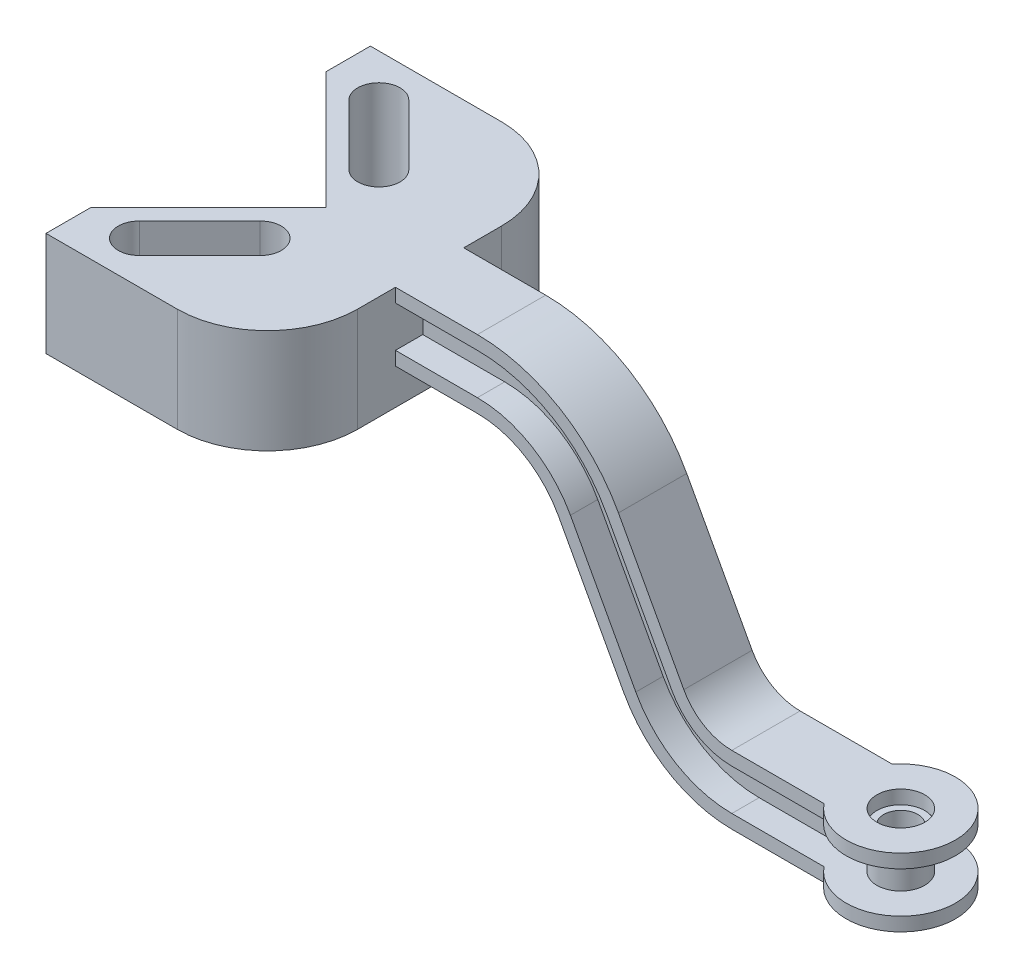
from build123d import *

# Parameters (mm, degrees)
BOSS_EXTRUDE1_DEPTH = 10
BOSS_EXTRUDE2_DEPTH = 50
BOSS_EXTRUDE5_START = 20
BOSS_EXTRUDE5_DEPTH = 152.5
BOSS_EXTRUDE6_START = -421.013827
SKETCH5_3_R         = 80
SKETCH5_3_R_2       = 35
BOSS_EXTRUDE6_DEPTH = 20
BOSS_EXTRUDE7_START = -341.013827
SKETCH5_4_R         = 80
SKETCH5_4_R_2       = 35
BOSS_EXTRUDE7_DEPTH = 20
BOSS_EXTRUDE8_START = -401.013827
SKETCH5_5_R         = 35
SKETCH5_5_R_2       = 25
BOSS_EXTRUDE8_DEPTH = 60


with BuildPart() as part:
    # Sketch3 → Boss-Extrude1 (new, symmetric)
    with BuildSketch(Plane.XY):
        with BuildLine():
            Line((256.220121409, -141.046781521), (351.935681127, -317.352633161))
            ThreePointArc((351.935681127, -317.352633161), (410.739881395, -378.516934204), (492.55, -401.013826989))
            Line((492.55, -401.013826989), (627.55, -401.013826989))
            Line((627.55, -401.013826989), (627.55, -341.013826989))
            Line((627.55, -341.013826989), (492.55, -341.013826989))
            ThreePointArc((492.55, -341.013826989), (441.418675872, -326.953268998), (404.666050704, -288.725580846))
            Line((404.666050704, -288.725580846), (308.950490986, -112.419729206))
            ThreePointArc((308.950490986, -112.419729206), (229.932346876, -30.23019968), (120, 0))
            Line((120, 0), (0, 0))
            Line((0, 0), (0, -60))
            Line((0, -60), (120, -60))
            ThreePointArc((120, -60), (199.253552399, -81.793864886), (256.220121409, -141.046781521))
        make_face()
    extrude(amount=BOSS_EXTRUDE1_DEPTH, both=True)

    # Sketch3<3> → Boss-Extrude2 (add, symmetric)
    with BuildSketch(Plane.XY):
        with BuildLine():
            ThreePointArc((422.242840563, -279.183230075), (451.644940697, -309.765380596), (492.55, -321.013826989))
            Line((492.55, -321.013826989), (627.55, -321.013826989))
            Line((627.55, -321.013826989), (627.55, -341.013826989))
            Line((627.55, -341.013826989), (492.55, -341.013826989))
            ThreePointArc((492.55, -341.013826989), (441.418675872, -326.953268998), (404.666050704, -288.725580846))
            Line((404.666050704, -288.725580846), (308.950490986, -112.419729206))
            ThreePointArc((308.950490986, -112.419729206), (229.932346876, -30.23019968), (120, 0))
            Line((120, 0), (0, 0))
            Line((0, 0), (0, 20))
            Line((0, 20), (120, 20))
            ThreePointArc((120, 20), (240.158611702, -13.042311278), (326.527280845, -102.877378435))
            Line((326.527280845, -102.877378435), (422.242840563, -279.183230075))
        make_face()
        with BuildLine():
            Line((238.643331549, -150.589132292), (334.358891267, -326.894983932))
            ThreePointArc((334.358891267, -326.894983932), (400.513616569, -395.704822605), (492.55, -421.013826989))
            Line((492.55, -421.013826989), (627.55, -421.013826989))
            Line((627.55, -421.013826989), (627.55, -401.013826989))
            Line((627.55, -401.013826989), (492.55, -401.013826989))
            ThreePointArc((492.55, -401.013826989), (410.739881395, -378.516934204), (351.935681127, -317.352633161))
            Line((351.935681127, -317.352633161), (256.220121409, -141.046781521))
            ThreePointArc((256.220121409, -141.046781521), (199.253552399, -81.793864886), (120, -60))
            Line((120, -60), (0, -60))
            Line((0, -60), (0, -80))
            Line((0, -80), (120, -80))
            ThreePointArc((120, -80), (189.027287573, -98.981753287), (238.643331549, -150.589132292))
        make_face()
    extrude(amount=BOSS_EXTRUDE2_DEPTH, both=True)

    # Sketch5 → Boss-Extrude5 (add)
    with BuildSketch(Plane(origin=(0, 0, 0), x_dir=(1, 0, 0), z_dir=(0, 1, 0)).offset(BOSS_EXTRUDE5_START)):
        with BuildLine():
            Line((0, 105.5), (0, -105.5))
            ThreePointArc((0, -105.5), (-38.661904883, -198.838095117), (-132, -237.5))
            Line((-132, -237.5), (-324.201420932, -237.5))
            Line((-324.201420932, -237.5), (-324.201420932, -172.5))
            Line((-324.201420932, -172.5), (-151.701420932, 0))
            Line((-151.701420932, 0), (-324.201420932, 172.5))
            Line((-324.201420932, 172.5), (-324.201420932, 237.5))
            Line((-324.201420932, 237.5), (-132, 237.5))
            ThreePointArc((-132, 237.5), (-38.661904883, 198.838095117), (0, 105.5))
        make_face()
        with BuildLine():
            ThreePointArc((-139.289922132, -108.847469931), (-139.289922132, -65.006849498), (-183.130542565, -65.006849498))
            Line((-183.130542565, -65.006849498), (-271.518890214, -153.395197146))
            ThreePointArc((-271.518890214, -153.395197146), (-271.518890214, -197.23581758), (-227.67826978, -197.23581758))
            Line((-227.67826978, -197.23581758), (-139.289922132, -108.847469931))
        make_face(mode=Mode.SUBTRACT)
        with BuildLine():
            Line((-227.67826978, 197.23581758), (-139.289922132, 108.847469931))
            ThreePointArc((-139.289922132, 108.847469931), (-139.289922132, 65.006849498), (-183.130542565, 65.006849498))
            Line((-183.130542565, 65.006849498), (-271.518890214, 153.395197146))
            ThreePointArc((-271.518890214, 153.395197146), (-271.518890214, 197.23581758), (-227.67826978, 197.23581758))
        make_face(mode=Mode.SUBTRACT)
    extrude(amount=-BOSS_EXTRUDE5_DEPTH)

    # Sketch5<3> → Boss-Extrude6 (add)
    # profile 1 of 3: a face of its own
    with BuildSketch(Plane(origin=(0, 0, 0), x_dir=(1, 0, 0), z_dir=(0, 1, 0)).offset(BOSS_EXTRUDE6_START)):
        with Locations((690, 0)):
            Circle(SKETCH5_3_R)
        with Locations(Location((690, 0, 0), (0, 0, 90))):
            Circle(SKETCH5_3_R_2, mode=Mode.SUBTRACT)
    # profile 2 of 3: a face of its own
    with BuildSketch(Plane(origin=(0, 0, 0), x_dir=(1, 0, 0), z_dir=(0, 1, 0)).offset(BOSS_EXTRUDE6_START)):
        with BuildLine():
            ThreePointArc((656.458980338, -10), (655, 0), (656.458980338, 10))
            Line((656.458980338, 10), (610.627460668, 10))
            ThreePointArc((610.627460668, 10), (610, 0), (610.627460668, -10))
            Line((610.627460668, -10), (656.458980338, -10))
        make_face()
    # profile 3 of 3: a face of its own
    with BuildSketch(Plane(origin=(0, 0, 0), x_dir=(1, 0, 0), z_dir=(0, 1, 0)).offset(BOSS_EXTRUDE6_START)):
        with BuildLine():
            Line((610.627460668, 10), (656.458980338, 10))
            ThreePointArc((656.458980338, 10), (695.052935375, 34.633334291), (725, 0))
            ThreePointArc((725, 0), (695.052935375, -34.633334291), (656.458980338, -10))
            Line((656.458980338, -10), (610.627460668, -10))
            ThreePointArc((610.627460668, -10), (695.009833003, -79.842980739), (770, 0))
            ThreePointArc((770, 0), (695.009833003, 79.842980739), (610.627460668, 10))
        make_face()
    extrude(amount=BOSS_EXTRUDE6_DEPTH)

    # Sketch5<4> → Boss-Extrude7 (add)
    # profile 1 of 3: a face of its own
    with BuildSketch(Plane(origin=(0, 0, 0), x_dir=(1, 0, 0), z_dir=(0, 1, 0)).offset(BOSS_EXTRUDE7_START)):
        with Locations((690, 0)):
            Circle(SKETCH5_4_R)
        with Locations(Location((690, 0, 0), (0, 0, 90))):
            Circle(SKETCH5_4_R_2, mode=Mode.SUBTRACT)
    # profile 2 of 3: a face of its own
    with BuildSketch(Plane(origin=(0, 0, 0), x_dir=(1, 0, 0), z_dir=(0, 1, 0)).offset(BOSS_EXTRUDE7_START)):
        with BuildLine():
            ThreePointArc((656.458980338, -10), (655, 0), (656.458980338, 10))
            Line((656.458980338, 10), (610.627460668, 10))
            ThreePointArc((610.627460668, 10), (610, 0), (610.627460668, -10))
            Line((610.627460668, -10), (656.458980338, -10))
        make_face()
    # profile 3 of 3: a face of its own
    with BuildSketch(Plane(origin=(0, 0, 0), x_dir=(1, 0, 0), z_dir=(0, 1, 0)).offset(BOSS_EXTRUDE7_START)):
        with BuildLine():
            Line((610.627460668, 10), (656.458980338, 10))
            ThreePointArc((656.458980338, 10), (695.052935375, 34.633334291), (725, 0))
            ThreePointArc((725, 0), (695.052935375, -34.633334291), (656.458980338, -10))
            Line((656.458980338, -10), (610.627460668, -10))
            ThreePointArc((610.627460668, -10), (695.009833003, -79.842980739), (770, 0))
            ThreePointArc((770, 0), (695.009833003, 79.842980739), (610.627460668, 10))
        make_face()
    extrude(amount=BOSS_EXTRUDE7_DEPTH)


with BuildPart() as body_2:
    # Sketch5<5> → Boss-Extrude8 (new body)
    # profile 1 of 2: a face of its own
    with BuildSketch(Plane(origin=(0, 0, 0), x_dir=(1, 0, 0), z_dir=(0, 1, 0)).offset(BOSS_EXTRUDE8_START)):
        with Locations(Location((690, 0, 0), (0, 0, 90))):
            Circle(SKETCH5_5_R)
        with Locations(Location((690, 0, 0), (0, 0, 90))):
            Circle(SKETCH5_5_R_2, mode=Mode.SUBTRACT)
    # profile 2 of 2: a face of its own
    with BuildSketch(Plane(origin=(0, 0, 0), x_dir=(1, 0, 0), z_dir=(0, 1, 0)).offset(BOSS_EXTRUDE8_START)):
        with BuildLine():
            ThreePointArc((656.458980338, -10), (655, 0), (656.458980338, 10))
            Line((656.458980338, 10), (610.627460668, 10))
            ThreePointArc((610.627460668, 10), (610, 0), (610.627460668, -10))
            Line((610.627460668, -10), (656.458980338, -10))
        make_face()
    extrude(amount=BOSS_EXTRUDE8_DEPTH)


solid = Compound([part.part, body_2.part])
